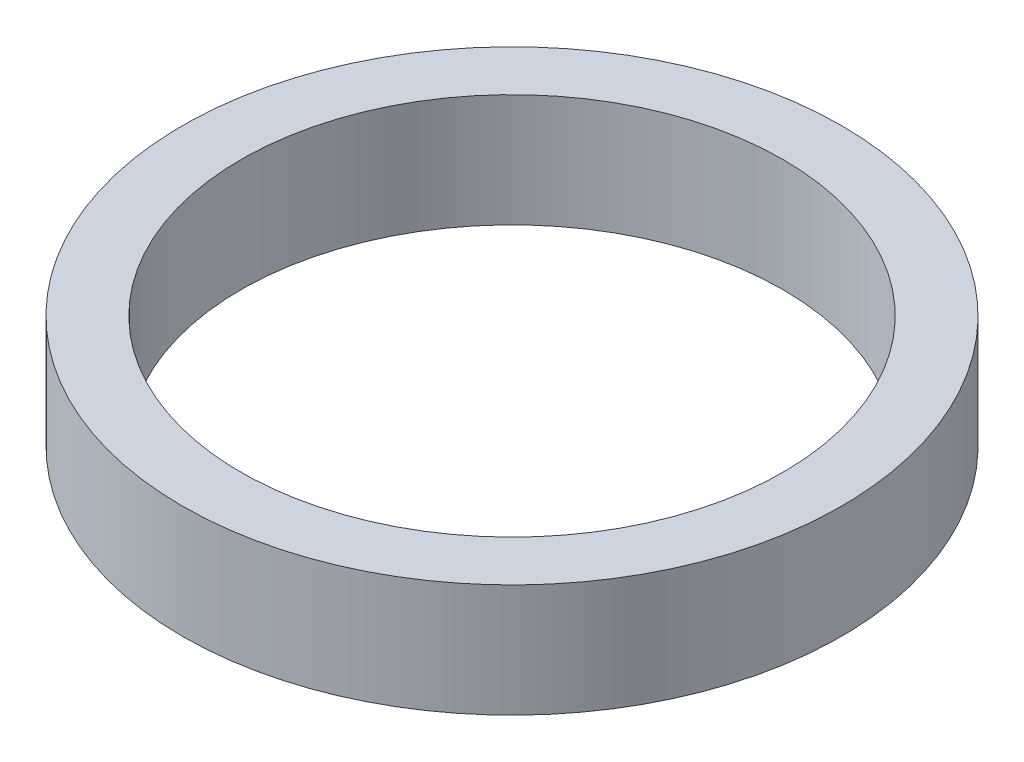
from build123d import *

# Parameters (mm, degrees)
SKETCH1_R           = 22.5
SKETCH1_R_2         = 18.5
BOSS_EXTRUDE1_DEPTH = 7.7


with BuildPart() as part:
    # Sketch1 → Boss-Extrude1 (new body)
    with BuildSketch(Plane(origin=(0, 0, 0), x_dir=(1, 0, 0), z_dir=(0, 1, 0))):
        Circle(SKETCH1_R)
        Circle(SKETCH1_R_2, mode=Mode.SUBTRACT)
    extrude(amount=BOSS_EXTRUDE1_DEPTH)


solid = part.part
